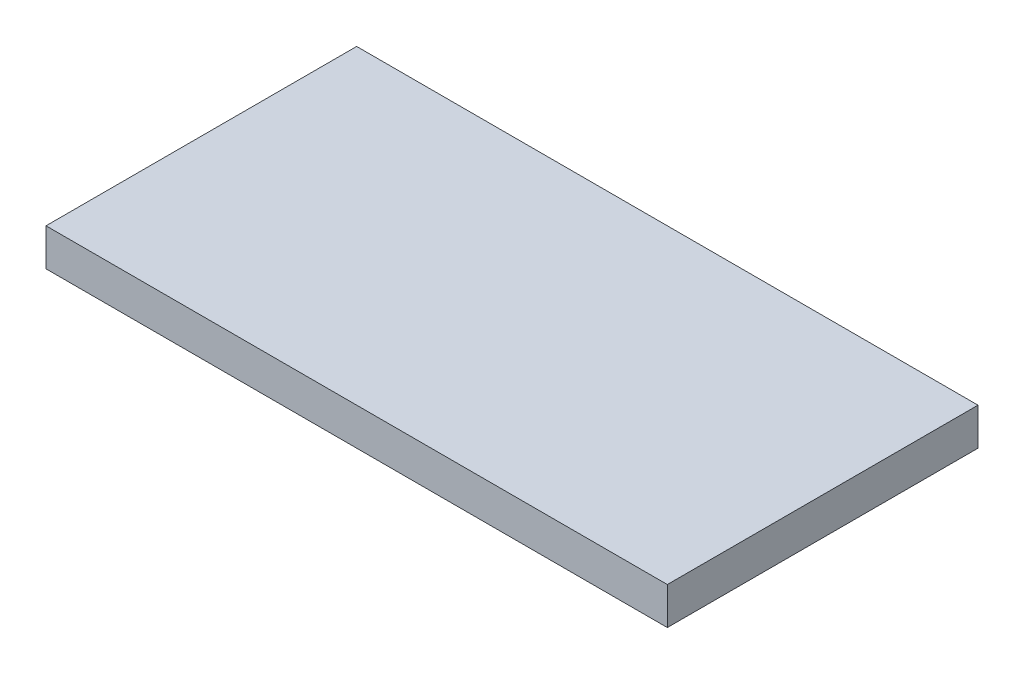
from build123d import *

# Parameters (mm, degrees)
SKETCH1_W           = 100
SKETCH1_H           = 50
BOSS_EXTRUDE1_DEPTH = 6


with BuildPart() as part:
    # Sketch1 → Boss-Extrude1 (new body)
    with BuildSketch(Plane(origin=(0, 0, 0), x_dir=(1, 0, 0), z_dir=(0, 1, 0))):
        with Locations((50, 25)):
            Rectangle(SKETCH1_W, SKETCH1_H)
    extrude(amount=BOSS_EXTRUDE1_DEPTH)


solid = part.part
